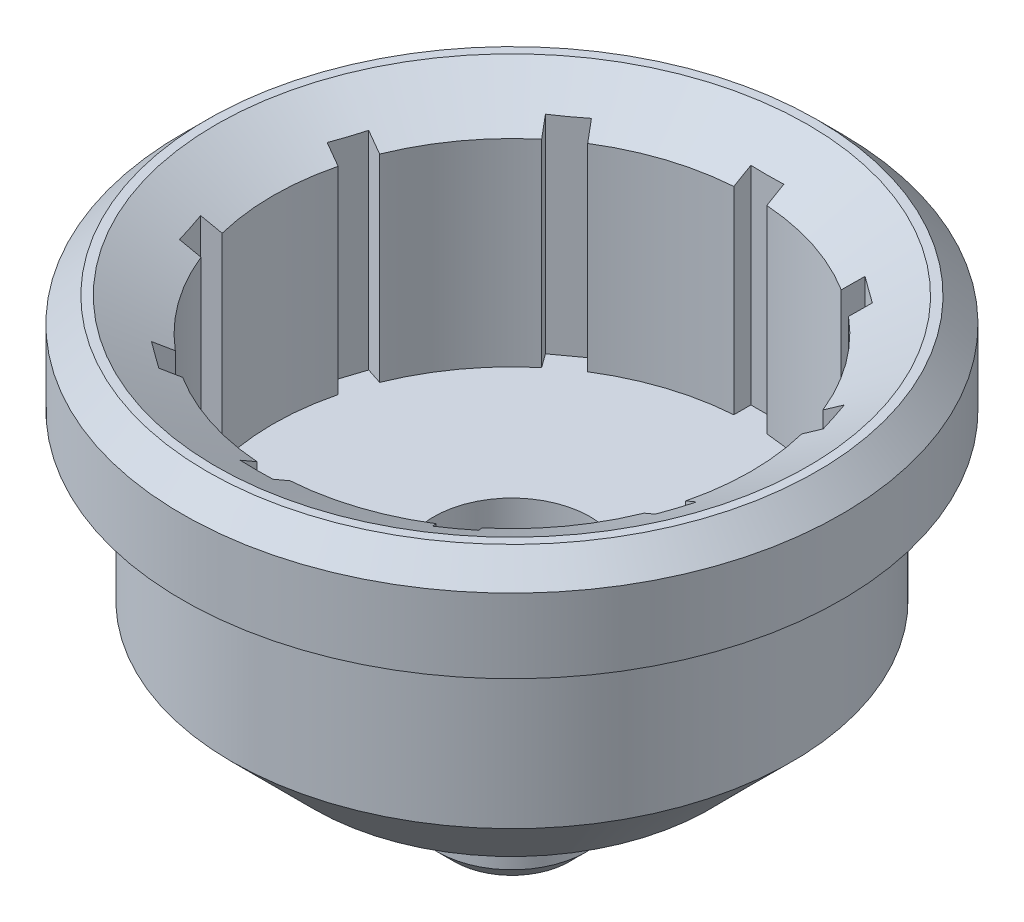
from build123d import *

# Parameters (mm, degrees)
CHAMFER_1_SIZE           = 2
CHAMFER_1_SIZE2          = 3.464101615
CHAMFER_2_SIZE           = 1.5
SKETCH_2_W               = 2
SKETCH_2_H               = 31
CUT_EXTRUDE_1_DEPTH      = 32.559467676
PATTERN_CIRCULAR_1_COUNT = 10
CHAMFER_3_SIZE           = 5
CHAMFER_4_SIZE           = 1


with BuildPart() as part:
    # 草图1 → 旋转1 (revolve)
    with BuildSketch(Plane.XY, mode=Mode.PRIVATE) as revolve_1_sk:
        Polygon((-2.5, 0), (-2.5, 10), (-4.75, 10), (-4.75, 14), (-14.5, 14), (-14.5, 28), (-20, 28), (-20, 22), (-17, 22), (-17, 7), (-6.5, 7), (-6.5, 6), (-4.5, 6), (-4.5, 0), align=None)
    revolve(revolve_1_sk.sketch.rotate(Axis((0, 0, 0), (0, 1, 0)), 270), axis=Axis((0, 0, 0), (0, 1, 0)))

    # 倒角1
    chamfer_1_edges = [part.edges().sort_by_distance(p)[0] for p in [
        (0, 28, 14.5),
    ]]
    chamfer_1_side = [part.faces().sort_by_distance(p)[0] for p in [
        (0, 21, 14.5),
    ]]
    chamfer(chamfer_1_edges, length=CHAMFER_1_SIZE, length2=CHAMFER_1_SIZE2, reference=chamfer_1_side[0])

    # 倒角2
    chamfer_2_edges = [part.edges().sort_by_distance(p)[0] for p in [
        (0, 28, 20),
    ]]
    chamfer(chamfer_2_edges, length=CHAMFER_2_SIZE)

    # 草图2 → 切除-拉伸1 (cut, through all)
    with BuildSketch(Plane(origin=(0, 14, 0), x_dir=(1, 0, 0), z_dir=(0, 1, 0))):
        Rectangle(SKETCH_2_W, SKETCH_2_H)
    cut_extrude_1 = extrude(amount=CUT_EXTRUDE_1_DEPTH, mode=Mode.SUBTRACT)

    # 阵列(圆周)1: 切除-拉伸1 ×10 about axis
    pattern_circular_1_axis = Axis((0, 0, 0), (0, 1, 0))
    for i in range(1, PATTERN_CIRCULAR_1_COUNT):
        add(cut_extrude_1.rotate(pattern_circular_1_axis, i * 360 / PATTERN_CIRCULAR_1_COUNT), mode=Mode.SUBTRACT)

    # 倒角3
    chamfer_3_edges = [part.edges().sort_by_distance(p)[0] for p in [
        (0, 7, 17),
    ]]
    chamfer(chamfer_3_edges, length=CHAMFER_3_SIZE)

    # 倒角4
    chamfer_4_edges = [part.edges().sort_by_distance(p)[0] for p in [
        (0, 0, 4.5),
    ]]
    chamfer(chamfer_4_edges, length=CHAMFER_4_SIZE)


solid = part.part
